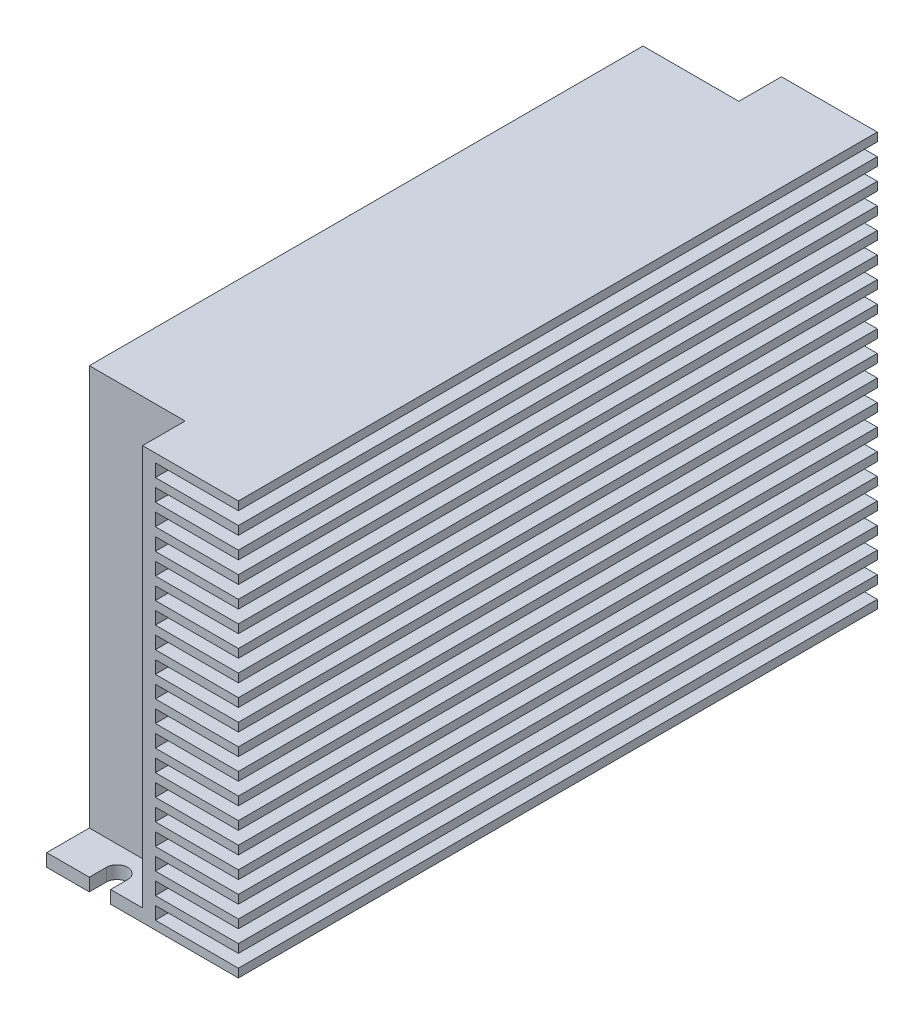
from build123d import *

# Parameters (mm, degrees)
SKETCH1_W           = 45
SKETCH1_H           = 150
BOSS_EXTRUDE1_DEPTH = 97
SKETCH2_W           = 22.5
SKETCH2_H           = 10
CUT_EXTRUDE1_DEPTH  = 94
CUT_EXTRUDE2_DEPTH  = 183.649938407
SKETCH4_W           = 19.5
SKETCH4_H           = 3
CUT_EXTRUDE3_DEPTH  = 185.211834582
LPATTERN1_COUNT     = 19
LPATTERN1_PITCH     = 5


with BuildPart() as part:
    # Sketch1 → Boss-Extrude1 (new body)
    with BuildSketch(Plane(origin=(0, 0, 0), x_dir=(1, 0, 0), z_dir=(0, 1, 0))):
        with Locations((22.5, 75)):
            Rectangle(SKETCH1_W, SKETCH1_H)
    extrude(amount=BOSS_EXTRUDE1_DEPTH)

    # Sketch2 → Cut-Extrude1 (cut)
    with BuildSketch(Plane(origin=(0, 97, 0), x_dir=(1, 0, 0), z_dir=(0, 1, 0))):
        with Locations((11.25, 145)):
            Rectangle(SKETCH2_W, SKETCH2_H)
    cut_extrude1 = extrude(amount=-CUT_EXTRUDE1_DEPTH, mode=Mode.SUBTRACT)

    # Sketch3 → Cut-Extrude2 (cut, through all)
    with BuildSketch(Plane(origin=(0, 3, 0), x_dir=(1, 0, 0), z_dir=(0, 1, 0))):
        with BuildLine():
            Line((10, 150), (10, 146))
            ThreePointArc((10, 146), (12.5, 143.5), (15, 146))
            Line((15, 146), (15, 150))
            Line((15, 150), (10, 150))
        make_face()
    cut_extrude2 = extrude(amount=-CUT_EXTRUDE2_DEPTH, mode=Mode.SUBTRACT)

    # Mirror1: Cut-Extrude1, Cut-Extrude2 across plane
    add(cut_extrude1.mirror(Plane.XY.offset(-75)), mode=Mode.SUBTRACT)
    add(cut_extrude2.mirror(Plane.XY.offset(-75)), mode=Mode.SUBTRACT)

    # Sketch4 → Cut-Extrude3 (cut, through all)
    with BuildSketch(Plane.XY):
        with Locations((35.25, 93.5)):
            Rectangle(SKETCH4_W, SKETCH4_H)
    cut_extrude3 = extrude(amount=-CUT_EXTRUDE3_DEPTH, mode=Mode.SUBTRACT)

    # LPattern1: Cut-Extrude3 ×19
    with Locations(*[(0, -i * LPATTERN1_PITCH, 0) for i in range(1, LPATTERN1_COUNT)]):
        add(cut_extrude3, mode=Mode.SUBTRACT)


solid = part.part
